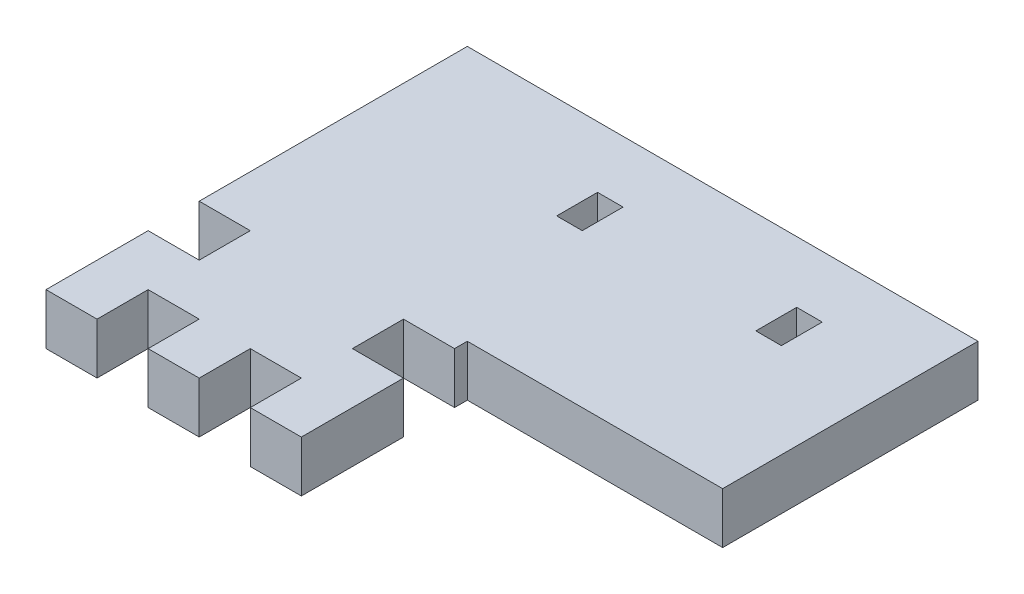
from build123d import *

# Parameters (mm, degrees)
BOSS_EXTRUDE1_DEPTH = 2.54
SKETCH2_W           = 2.54
SKETCH2_H           = 2.54
CUT_EXTRUDE1_DEPTH  = 34.026105205
SKETCH3_W           = 1.27
SKETCH3_H           = 2.032
CUT_EXTRUDE2_DEPTH  = 34.026105205
SKETCH4_W           = 2.54
SKETCH4_H           = 2.54
CUT_EXTRUDE3_DEPTH  = 34.026105205


with BuildPart() as part:
    # Sketch1 → Boss-Extrude1 (new body)
    with BuildSketch(Plane(origin=(0, 0, 0), x_dir=(1, 0, 0), z_dir=(0, 1, 0))):
        Polygon((0, 0), (0, 20.955), (25.4, 20.955), (25.4, 8.255), (12.7, 8.255), (12.7, 0), align=None)
    extrude(amount=BOSS_EXTRUDE1_DEPTH)

    # Sketch2 → Cut-Extrude1 (cut, through all)
    with BuildSketch(Plane(origin=(0, 2.54, 0), x_dir=(1, 0, 0), z_dir=(0, 1, 0))):
        with Locations((3.81, 1.27)):
            Rectangle(SKETCH2_W, SKETCH2_H)
        with Locations((8.89, 1.27)):
            Rectangle(SKETCH2_W, SKETCH2_H)
    extrude(amount=-CUT_EXTRUDE1_DEPTH, mode=Mode.SUBTRACT)

    # Sketch3 → Cut-Extrude2 (cut, through all)
    with BuildSketch(Plane(origin=(0, 2.54, 0), x_dir=(1, 0, 0), z_dir=(0, 1, 0))):
        with Locations((10.16, 16.891)):
            Rectangle(SKETCH3_W, SKETCH3_H)
        with Locations((20.066, 16.891)):
            Rectangle(SKETCH3_W, SKETCH3_H)
    extrude(amount=-CUT_EXTRUDE2_DEPTH, mode=Mode.SUBTRACT)

    # Sketch4 → Cut-Extrude3 (cut, through all)
    with BuildSketch(Plane(origin=(0, 2.54, 0), x_dir=(1, 0, 0), z_dir=(0, 1, 0))):
        with Locations((1.27, 6.35)):
            Rectangle(SKETCH4_W, SKETCH4_H)
        with Locations((11.43, 6.35)):
            Rectangle(SKETCH4_W, SKETCH4_H)
    extrude(amount=-CUT_EXTRUDE3_DEPTH, mode=Mode.SUBTRACT)


solid = part.part
